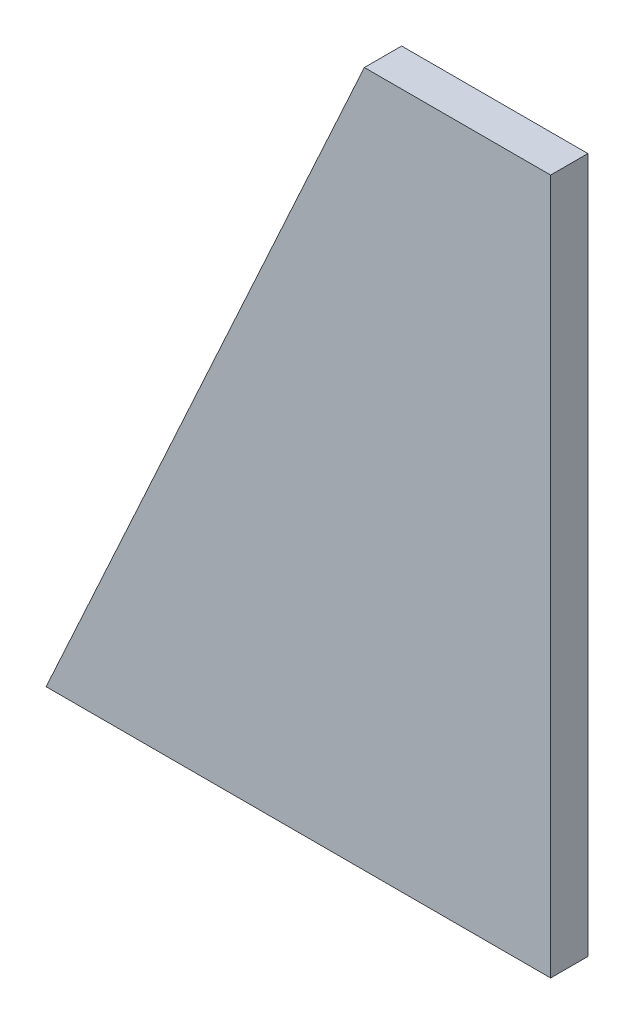
from build123d import *

# Parameters (mm, degrees)
RESSALTO_EXTRUS_O1_DEPTH = 3


with BuildPart() as part:
    # Esboço1 → Ressalto-extrusão1 (new body)
    with BuildSketch(Plane.XY):
        Polygon((0, 0), (0, 56), (-15, 56), (-40.63, 0), align=None)
    extrude(amount=RESSALTO_EXTRUS_O1_DEPTH)


solid = part.part
